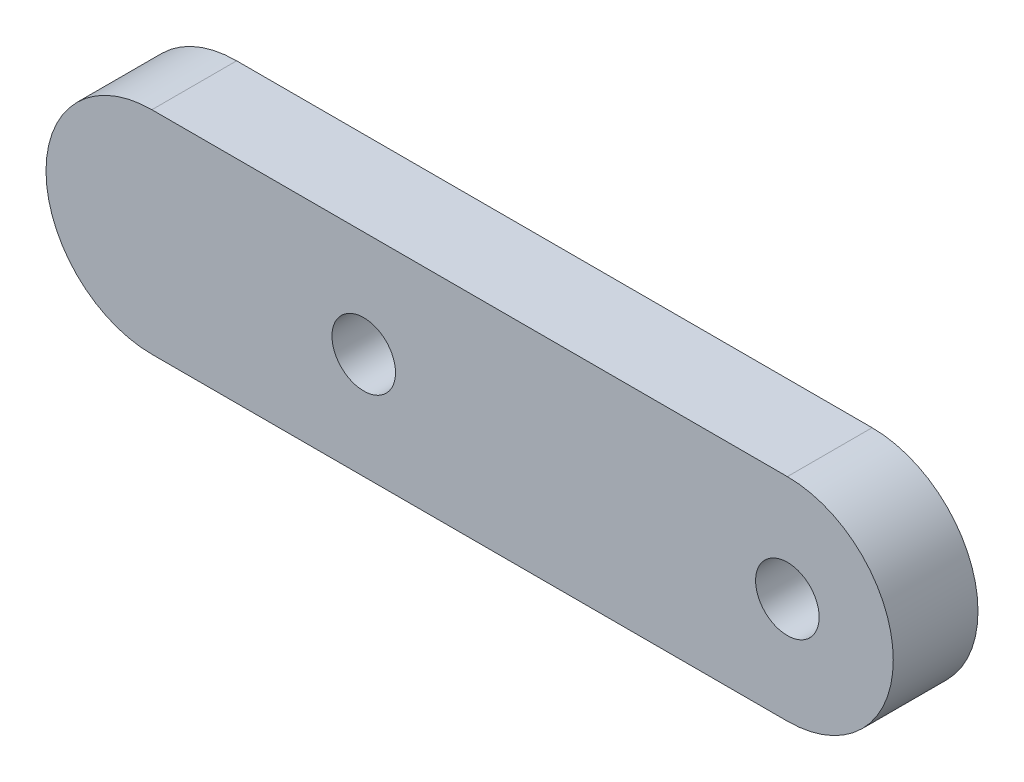
from build123d import *

# Parameters (mm, degrees)
ESQUISSE1_R        = 1.5
BOSS_EXTRU_1_DEPTH = 4


with BuildPart() as part:
    # Esquisse1 → Boss.-Extru.1 (new body)
    with BuildSketch(Plane.XY):
        with BuildLine():
            Line((-15, 5), (15, 5))
            ThreePointArc((15, 5), (20, 0), (15, -5))
            Line((15, -5), (-15, -5))
            ThreePointArc((-15, -5), (-20, 0), (-15, 5))
        make_face()
        with Locations((15, 0)):
            Circle(ESQUISSE1_R, mode=Mode.SUBTRACT)
        with Locations((-5, 0)):
            Circle(ESQUISSE1_R, mode=Mode.SUBTRACT)
    extrude(amount=BOSS_EXTRU_1_DEPTH)


solid = part.part
